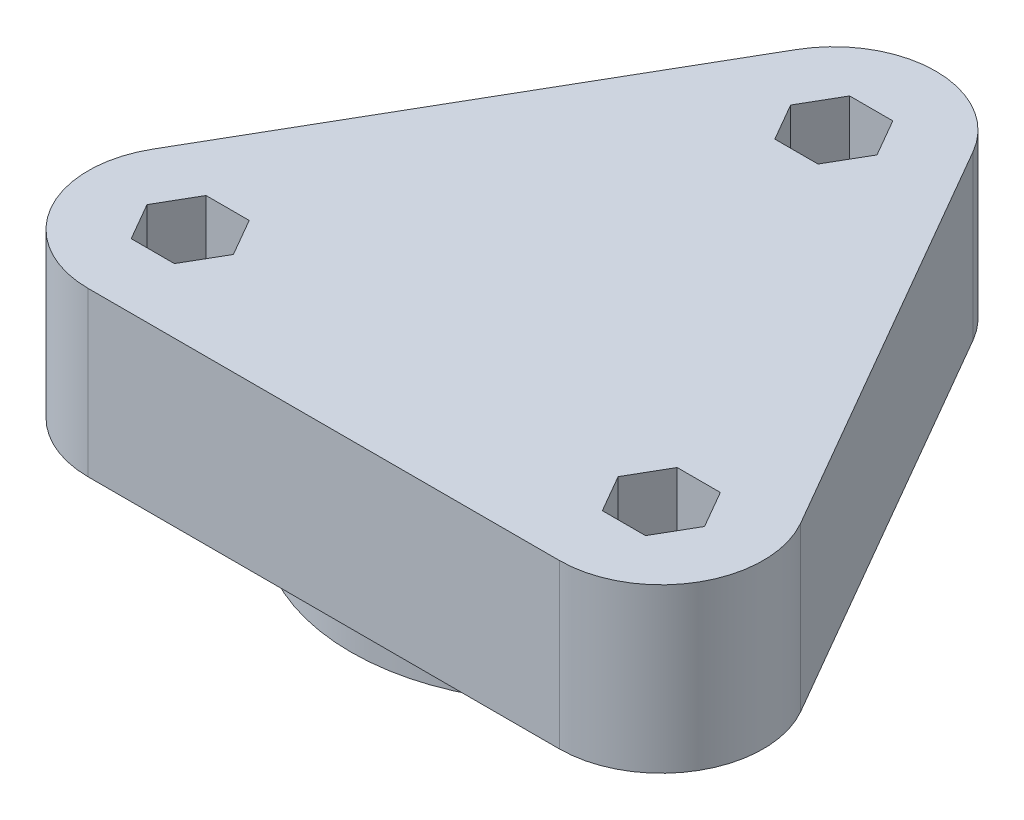
from build123d import *

# Parameters (mm, degrees)
ESQUISSE1_R             = 11.9
ESQUISSE1_R_2           = 1.6
BOSS_EXTRU_1_DEPTH      = 12
ENL_V_MAT_EXTRU_1_DEPTH = 5
BOSS_EXTRUDE1_START     = -3.5
SKETCH1_R               = 11.9
BOSS_EXTRUDE1_DEPTH     = 3.5
BOSS_EXTRUDE2_START     = 3.5
SKETCH2_R               = 15.5
SKETCH2_R_2             = 11.9
BOSS_EXTRUDE2_DEPTH     = 3.5


with BuildPart() as part:
    # Esquisse1 → Boss.-Extru.1 (new body)
    with BuildSketch(Plane(origin=(0, 0, 0), x_dir=(1, 0, 0), z_dir=(0, 1, 0))):
        with BuildLine():
            Line((-6.495190528, 23.75), (-23.815698604, -6.25))
            ThreePointArc((-23.815698604, -6.25), (-23.815698604, -13.75), (-17.320508076, -17.5))
            Line((-17.320508076, -17.5), (17.320508076, -17.5))
            ThreePointArc((17.320508076, -17.5), (23.815698604, -13.75), (23.815698604, -6.25))
            Line((23.815698604, -6.25), (6.495190528, 23.75))
            ThreePointArc((6.495190528, 23.75), (0, 27.5), (-6.495190528, 23.75))
        make_face()
        with Locations(Location((0, 0, 0), (0, 0, 90))):
            Circle(ESQUISSE1_R, mode=Mode.SUBTRACT)
        with Locations(Location((-17.320508076, -10, 0), (0, 0, 270))):
            Circle(ESQUISSE1_R_2, mode=Mode.SUBTRACT)
        with Locations(Location((0, 20, 0), (0, 0, 270))):
            Circle(ESQUISSE1_R_2, mode=Mode.SUBTRACT)
        with Locations(Location((17.320508076, -10, 0), (0, 0, 270))):
            Circle(ESQUISSE1_R_2, mode=Mode.SUBTRACT)
    extrude(amount=BOSS_EXTRU_1_DEPTH)

    # Esquisse2 → Enlèv. mat.-Extru.1 (cut)
    with BuildSketch(Plane(origin=(0, 12, 0), x_dir=(1, 0, 0), z_dir=(0, 1, 0))):
        Polygon((-18.908221316, -7.25), (-20.495934556, -10), (-18.908221316, -12.75), (-15.732794835, -12.75), (-14.145081595, -10), (-15.732794835, -7.25), align=None)
        Polygon((-1.58771324, 22.75), (-3.175426481, 20), (-1.58771324, 17.25), (1.58771324, 17.25), (3.175426481, 20), (1.58771324, 22.75), align=None)
        Polygon((18.908221316, -7.25), (15.732794835, -7.25), (14.145081595, -10), (15.732794835, -12.75), (18.908221316, -12.75), (20.495934556, -10), align=None)
    extrude(amount=-ENL_V_MAT_EXTRU_1_DEPTH, mode=Mode.SUBTRACT)

    # Sketch1 → Boss-Extrude1 (add)
    with BuildSketch(Plane(origin=(0, 12, 0), x_dir=(1, 0, 0), z_dir=(0, 1, 0)).offset(BOSS_EXTRUDE1_START)):
        with Locations(Location((0, 0, 0), (0, 0, 90))):
            Circle(SKETCH1_R)
    extrude(amount=BOSS_EXTRUDE1_DEPTH)

    # Sketch2 → Boss-Extrude2 (add)
    with BuildSketch(Plane.XZ.offset(BOSS_EXTRUDE2_START)):
        with Locations(Location((0, 0, 0), (0, 0, 90))):
            Circle(SKETCH2_R)
        with Locations(Location((0, 0, 0), (0, 0, 270))):
            Circle(SKETCH2_R_2, mode=Mode.SUBTRACT)
    extrude(amount=-BOSS_EXTRUDE2_DEPTH)


solid = part.part
